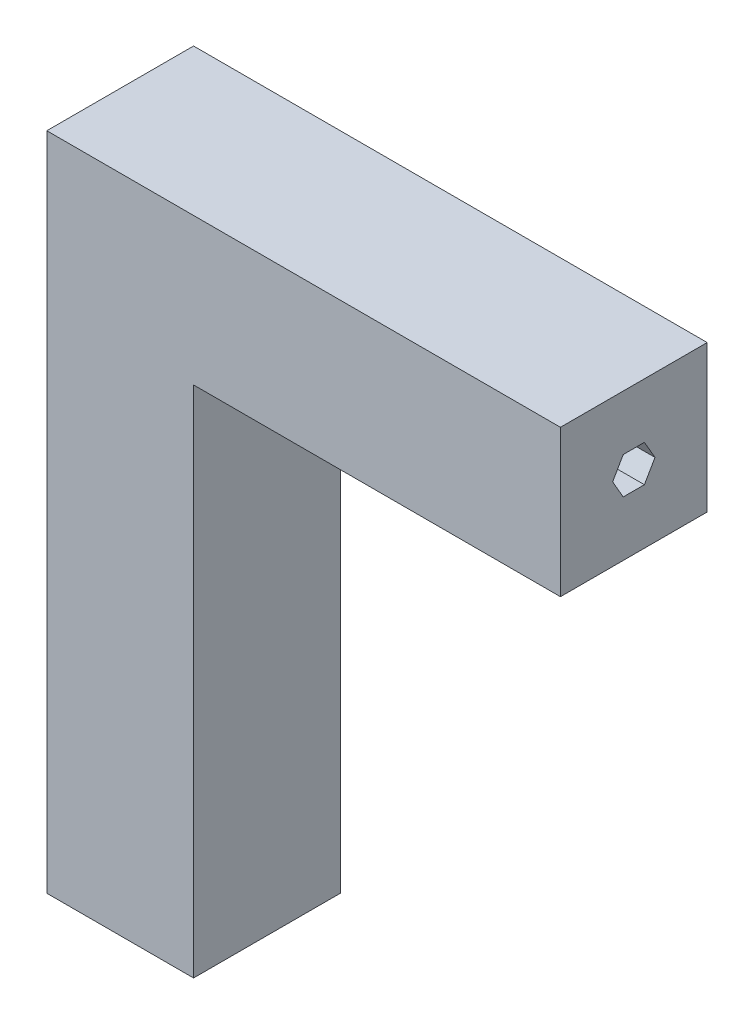
from build123d import *

# Parameters (mm, degrees)
BOSS_EXTRUDE1_DEPTH = 25.4
CUT_EXTRUDE1_DEPTH  = 76.2


with BuildPart() as part:
    # Sketch2 → Boss-Extrude1 (new, symmetric)
    with BuildSketch(Plane.XY):
        Polygon((0, 0), (50.8, 0), (50.8, 177.8), (177.8, 177.8), (177.8, 228.6), (50.8, 228.6), (0, 228.6), align=None)
    extrude(amount=BOSS_EXTRUDE1_DEPTH, both=True)

    # Sketch3 → Cut-Extrude1 (cut)
    with BuildSketch(Plane(origin=(177.8, 0, 0), x_dir=(0, 0, -1), z_dir=(1, 0, 0))):
        Polygon((7.332348419, 203.2), (3.666174209, 209.55), (-3.666174209, 209.55), (-7.332348419, 203.2), (-3.666174209, 196.85), (3.666174209, 196.85), align=None)
    extrude(amount=-CUT_EXTRUDE1_DEPTH, mode=Mode.SUBTRACT)


solid = part.part
